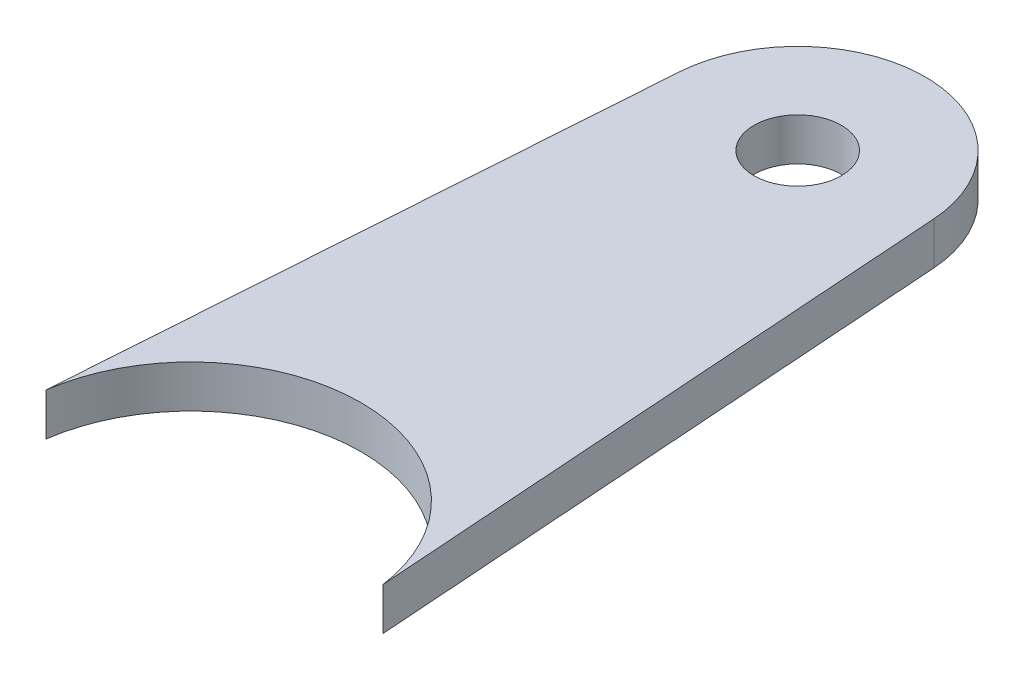
from build123d import *

# Parameters (mm, degrees)
SKETCH1_R           = 3.2639
BOSS_EXTRUDE1_DEPTH = 3.175


with BuildPart() as part:
    # Sketch1 → Boss-Extrude1 (new body)
    with BuildSketch(Plane(origin=(0, 0, 0), x_dir=(1, 0, 0), z_dir=(0, 1, 0))):
        with BuildLine():
            Line((3.197970198, 45.964541088), (0.122360007, 1.758684792))
            ThreePointArc((0.122360007, 1.758684792), (12.7, 12.7), (25.277639993, 1.758684792))
            Line((25.277639993, 1.758684792), (22.202029802, 45.964541088))
            ThreePointArc((22.202029802, 45.964541088), (12.7, 54.82844), (3.197970198, 45.964541088))
        make_face()
        with Locations(Location((12.7, 45.30344, 0), (0, 0, 270))):
            Circle(SKETCH1_R, mode=Mode.SUBTRACT)
    extrude(amount=BOSS_EXTRUDE1_DEPTH)


solid = part.part
